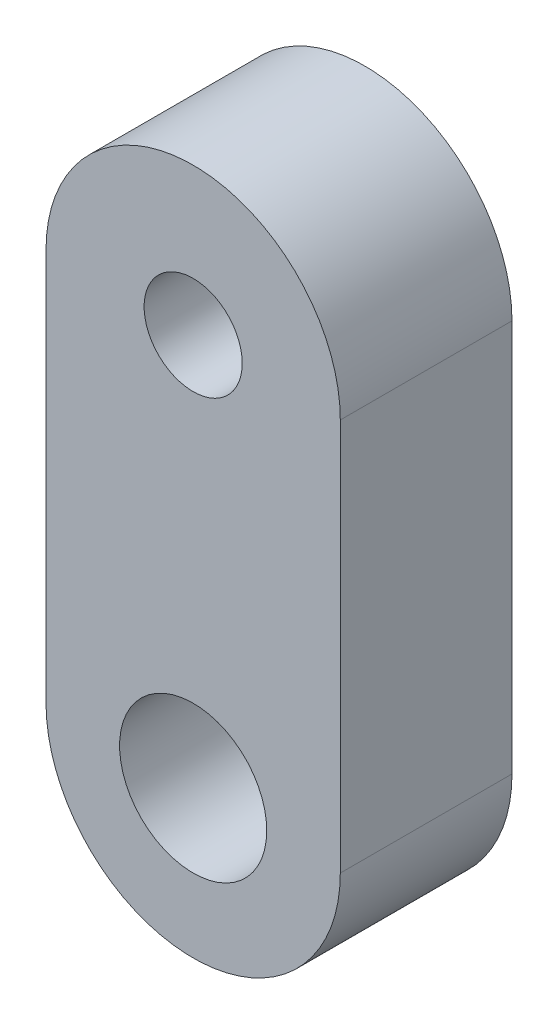
from build123d import *

# Parameters (mm, degrees)
SKETCH1_R           = 1.5
SKETCH1_R_2         = 1
BOSS_EXTRUDE1_DEPTH = 3.5


with BuildPart() as part:
    # Sketch1 → Boss-Extrude1 (new body)
    with BuildSketch(Plane.XY):
        with BuildLine():
            Line((-3, 0), (-3, 8))
            ThreePointArc((-3, 8), (0, 11), (3, 8))
            Line((3, 8), (3, 0))
            ThreePointArc((3, 0), (0, -3), (-3, 0))
        make_face()
        Circle(SKETCH1_R, mode=Mode.SUBTRACT)
        with Locations((0, 8)):
            Circle(SKETCH1_R_2, mode=Mode.SUBTRACT)
    extrude(amount=BOSS_EXTRUDE1_DEPTH)


solid = part.part
